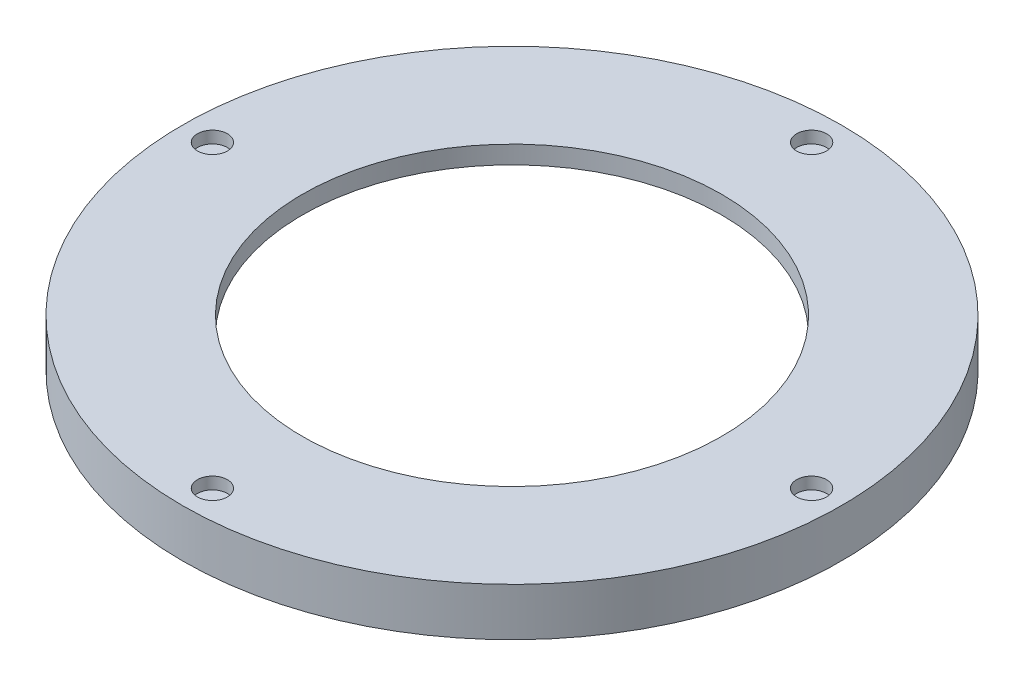
from build123d import *

# Parameters (mm, degrees)
SKETCH1_R           = 27.5
BOSS_EXTRUDE1_DEPTH = 4
SKETCH2_R           = 1.25
CUT_EXTRUDE1_DEPTH  = 1
SKETCH3_R           = 25
CUT_EXTRUDE5_DEPTH  = 2.5
SKETCH4_R           = 17.5
CUT_EXTRUDE6_DEPTH  = 39.97114317


with BuildPart() as part:
    # Sketch1 → Boss-Extrude1 (new body)
    with BuildSketch(Plane(origin=(0, 0, 0), x_dir=(1, 0, 0), z_dir=(0, 1, 0))):
        with Locations(Location((0, 0, 0), (0, 0, 270))):
            Circle(SKETCH1_R)
    extrude(amount=BOSS_EXTRUDE1_DEPTH)

    # Sketch2 → Cut-Extrude1 (cut)
    with BuildSketch(Plane(origin=(0, 4, 0), x_dir=(1, 0, 0), z_dir=(0, 1, 0))):
        with Locations(Location((0, 25, 0), (0, 0, 270))):
            Circle(SKETCH2_R)
        with Locations(Location((25, 0, 0), (0, 0, 270))):
            Circle(SKETCH2_R)
        with Locations(Location((0, -25, 0), (0, 0, 270))):
            Circle(SKETCH2_R)
        with Locations(Location((-25, 0, 0), (0, 0, 270))):
            Circle(SKETCH2_R)
    extrude(amount=-CUT_EXTRUDE1_DEPTH, mode=Mode.SUBTRACT)

    # Sketch3 → Cut-Extrude5 (cut)
    with BuildSketch(Plane(origin=(0, 0, 0), x_dir=(-1, 0, 0), z_dir=(0, -1, 0))):
        with Locations(Location((0, 0, 0), (0, 0, 90))):
            Circle(SKETCH3_R)
    extrude(amount=-CUT_EXTRUDE5_DEPTH, mode=Mode.SUBTRACT)

    # Sketch4 → Cut-Extrude6 (cut, through all)
    with BuildSketch(Plane(origin=(0, 2.5, 0), x_dir=(-1, 0, 0), z_dir=(0, -1, 0))):
        with Locations(Location((0, 0, 0), (0, 0, 90))):
            Circle(SKETCH4_R)
    extrude(amount=-CUT_EXTRUDE6_DEPTH, mode=Mode.SUBTRACT)


solid = part.part
